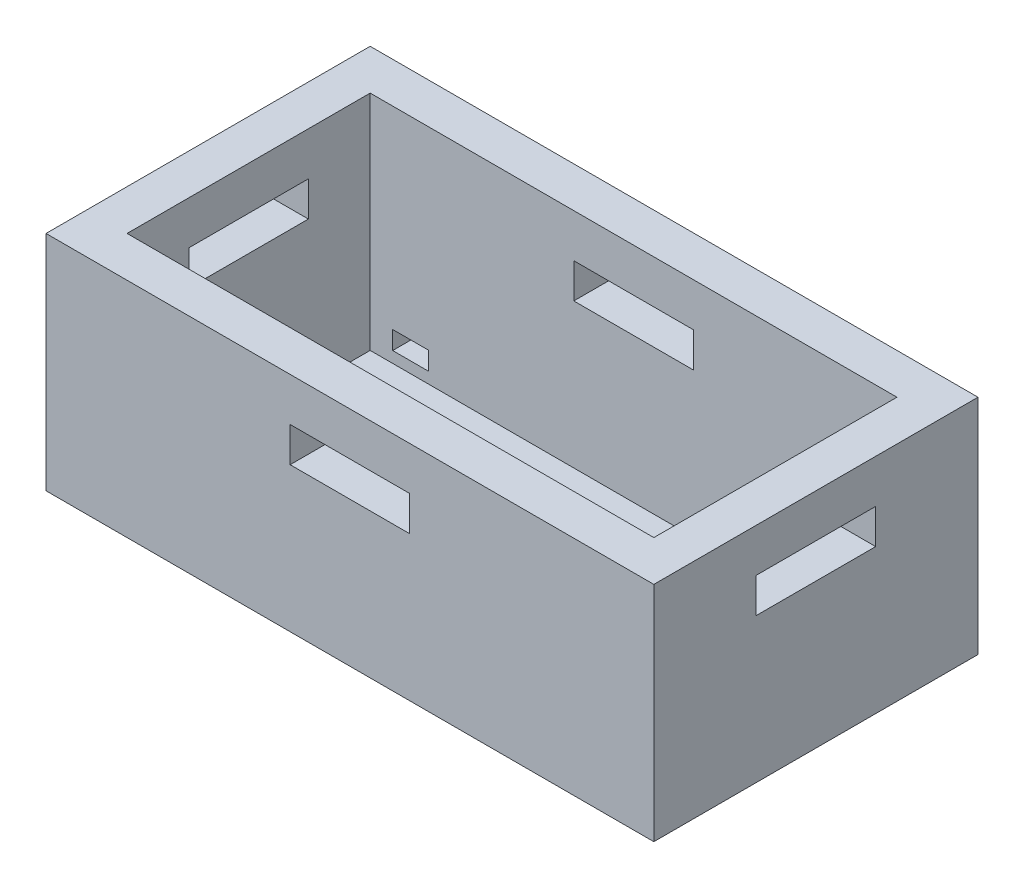
from build123d import *

# Parameters (mm, degrees)
CROQUIS1_W              = 130
CROQUIS1_H              = 60
SALIENTE_EXTRUIR1_DEPTH = 7.5
CROQUIS1_3_W            = 150
CROQUIS1_3_H            = 80
CROQUIS1_3_W_2          = 130
CROQUIS1_3_H_2          = 60
SALIENTE_EXTRUIR2_DEPTH = 55
CROQUIS2_W              = 7
CROQUIS2_H              = 8
CORTAR_EXTRUIR1_DEPTH   = 102.242283657
CROQUIS3_W              = 29.5
CROQUIS3_H              = 8.6
CORTAR_EXTRUIR2_DEPTH   = 123.678441464
CROQUIS4_W              = 8.9
CROQUIS4_H              = 4.5
CORTAR_EXTRUIR3_DEPTH   = 10
CROQUIS5_W              = 29.5
CROQUIS5_H              = 8.6
CORTAR_EXTRUIR4_DEPTH   = 165.69669092


with BuildPart() as part:
    # Croquis1 → Saliente-Extruir1 (new body)
    with BuildSketch(Plane(origin=(0, 0, 0), x_dir=(1, 0, 0), z_dir=(0, 1, 0))):
        Rectangle(CROQUIS1_W, CROQUIS1_H)
    extrude(amount=-SALIENTE_EXTRUIR1_DEPTH)

    # Croquis2 → Cortar-Extruir1 (cut, through all)
    with BuildSketch(Plane(origin=(0, 0, 0), x_dir=(1, 0, 0), z_dir=(0, 1, 0))):
        with Locations((61.5, 0)):
            Rectangle(CROQUIS2_W, CROQUIS2_H)
        with Locations((-61.5, 0)):
            Rectangle(CROQUIS2_W, CROQUIS2_H)
    extrude(amount=-CORTAR_EXTRUIR1_DEPTH, mode=Mode.SUBTRACT)


with BuildPart() as body_2:
    # Croquis1<3> → Saliente-Extruir2 (new body)
    with BuildSketch(Plane(origin=(0, 0, 0), x_dir=(1, 0, 0), z_dir=(0, 1, 0))):
        Rectangle(CROQUIS1_3_W, CROQUIS1_3_H)
        Rectangle(CROQUIS1_3_W_2, CROQUIS1_3_H_2, mode=Mode.SUBTRACT)
    extrude(amount=SALIENTE_EXTRUIR2_DEPTH)

    # Croquis3 → Cortar-Extruir2 (cut, through all)
    with BuildSketch(Plane.XY.offset(40)):
        with Locations((0, 40)):
            Rectangle(CROQUIS3_W, CROQUIS3_H)
    extrude(amount=-CORTAR_EXTRUIR2_DEPTH, mode=Mode.SUBTRACT)

    # Croquis4 → Cortar-Extruir3 (cut)
    with BuildSketch(Plane(origin=(0, 0, -40), x_dir=(-1, 0, 0), z_dir=(0, 0, -1))):
        with Locations((-55, 5)):
            Rectangle(CROQUIS4_W, CROQUIS4_H)
        with Locations((55, 5)):
            Rectangle(CROQUIS4_W, CROQUIS4_H)
    extrude(amount=-CORTAR_EXTRUIR3_DEPTH, mode=Mode.SUBTRACT)

    # Croquis5 → Cortar-Extruir4 (cut, through all)
    with BuildSketch(Plane(origin=(75, 0, 0), x_dir=(0, 0, -1), z_dir=(1, 0, 0))):
        with Locations((0, 40)):
            Rectangle(CROQUIS5_W, CROQUIS5_H)
    extrude(amount=-CORTAR_EXTRUIR4_DEPTH, mode=Mode.SUBTRACT)


solid = Compound([part.part, body_2.part])
